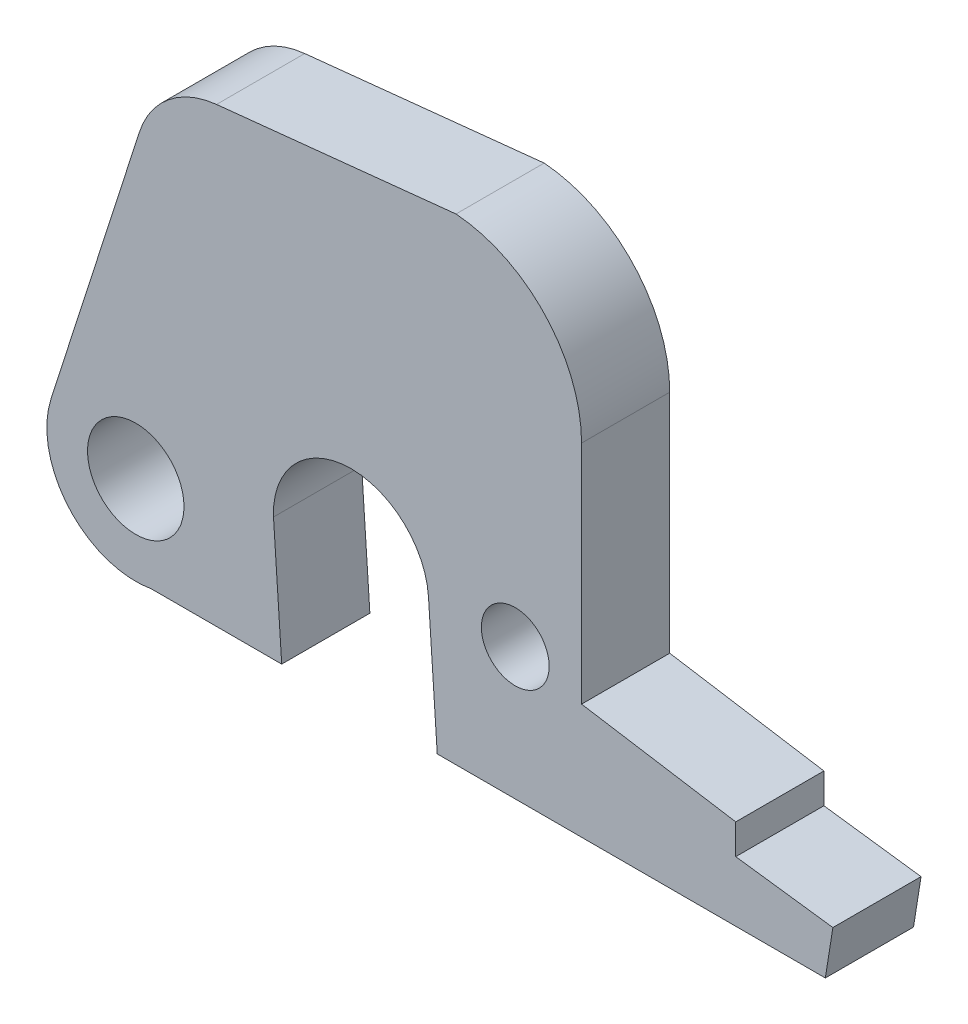
from build123d import *

# Parameters (mm, degrees)
SKETCH2_R           = 1.6256
SKETCH2_R_2         = 1.143
BOSS_EXTRUDE1_DEPTH = 1.4859


with BuildPart() as part:
    # Sketch2 → Boss-Extrude1 (new, symmetric)
    with BuildSketch(Plane.XY):
        with BuildLine():
            Line((1.669588526, -9.920736917), (14.750588526, -9.920736917))
            Line((14.750588526, -9.920736917), (15.004588526, -8.320536917))
            Line((15.004588526, -8.320536917), (11.730740811, -7.888736917))
            Line((11.730740811, -7.888736917), (11.730740811, -6.872736917))
            Line((11.730740811, -6.872736917), (6.533907217, -6.034536917))
            Line((6.533907217, -6.034536917), (6.533907217, 1.585463083))
            ThreePointArc((6.533907217, 1.585463083), (5.31342025, 4.700559773), (2.301635303, 6.157463083))
            Line((2.301635303, 6.157463083), (-5.77059015, 5.319263083))
            ThreePointArc((-5.77059015, 5.319263083), (-7.384864751, 4.650807821), (-8.371334953, 3.208728953))
            Line((-8.371334953, 3.208728953), (-11.346598434, -6.053267424))
            ThreePointArc((-11.346598434, -6.053267424), (-10.750121538, -8.941908183), (-7.96769015, -9.920736917))
            Line((-7.96769015, -9.920736917), (-3.57349015, -9.920736917))
            Line((-3.57349015, -9.920736917), (-3.850300754, -5.764344341))
            ThreePointArc((-3.850300754, -5.764344341), (-1.375609273, -3.046929144), (1.374211357, -5.485561912))
            Line((1.374211357, -5.485561912), (1.669588526, -9.920736917))
        make_face()
        with Locations((-8.493016303, -6.96993359)):
            Circle(SKETCH2_R, mode=Mode.SUBTRACT)
        with Locations((4.298707217, -5.475736917)):
            Circle(SKETCH2_R_2, mode=Mode.SUBTRACT)
    extrude(amount=BOSS_EXTRUDE1_DEPTH, both=True)


solid = part.part
